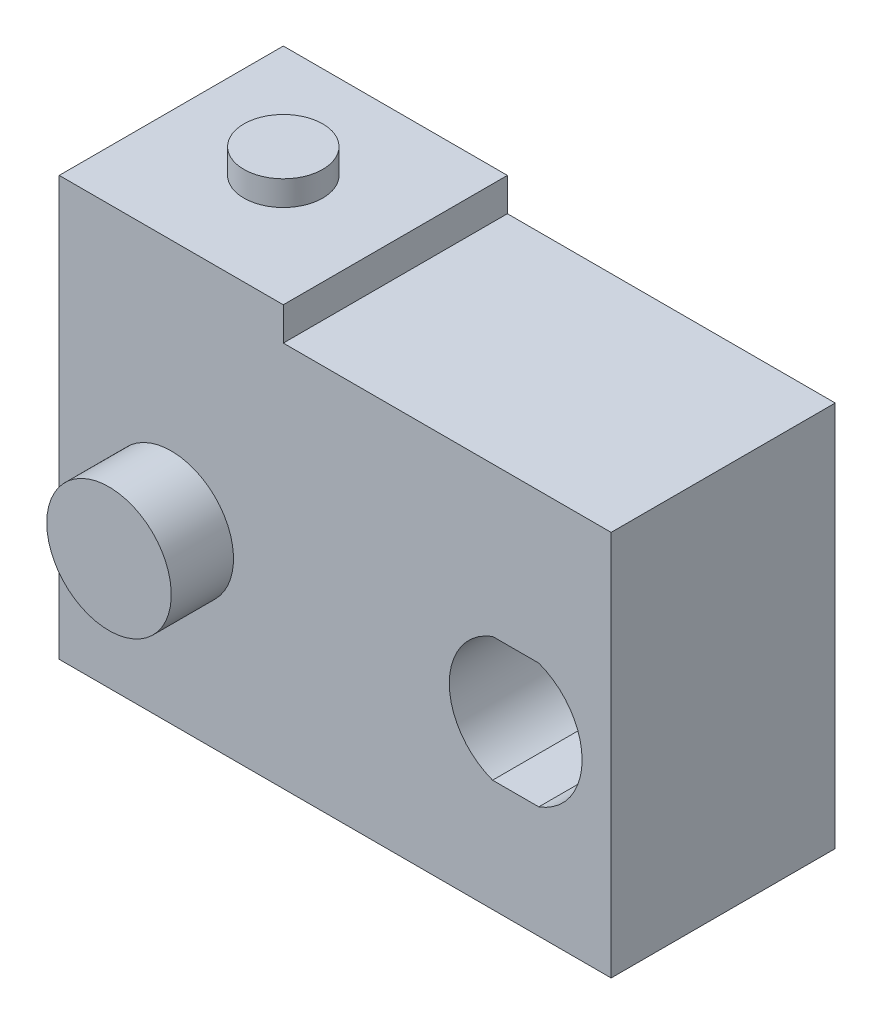
from build123d import *

# Parameters (mm, degrees)
BOSS_EXTRUDE1_DEPTH      = 2.7
BOSS_EXTRUDE2_DEPTH      = 4.2
BOSS_EXTRUDE2_DEPTH_BACK = 4.2
SKETCH3_R                = 1.5
SKETCH4_R                = 0.95
BOSS_EXTRUDE3_DEPTH      = 0.6


with BuildPart() as part:
    # Sketch1 → Boss-Extrude1 (new, symmetric)
    with BuildSketch(Plane.XY):
        Polygon((6.65, -4.65), (-6.65, -4.65), (-6.65, 4.65), (-6.65, 5.45), (-1.25, 5.45), (-1.25, 4.65), (6.65, 4.65), align=None)
        with BuildLine():
            Line((3.793223564, 1.05), (4.906776436, 1.05))
            ThreePointArc((4.906776436, 1.05), (5.95, -0.45), (4.906776436, -1.95))
            Line((4.906776436, -1.95), (3.793223564, -1.95))
            ThreePointArc((3.793223564, -1.95), (2.75, -0.45), (3.793223564, 1.05))
        make_face(mode=Mode.SUBTRACT)
    extrude(amount=BOSS_EXTRUDE1_DEPTH, both=True)

    # Sketch3 → Boss-Extrude2 (add, two sides: drawn at the far end of the back side and taken through both)
    with BuildSketch(Plane.XY.offset(-BOSS_EXTRUDE2_DEPTH_BACK)):
        with Locations(Location((-3.95, -0.45, 0), (0, 0, 180))):
            Circle(SKETCH3_R)
    extrude(amount=BOSS_EXTRUDE2_DEPTH + BOSS_EXTRUDE2_DEPTH_BACK)

    # Sketch4 → Boss-Extrude3 (add)
    with BuildSketch(Plane(origin=(0, 5.45, 0), x_dir=(1, 0, 0), z_dir=(0, 1, 0))):
        with Locations(Location((-3.95, 0, 0), (0, 0, 180))):
            Circle(SKETCH4_R)
    extrude(amount=BOSS_EXTRUDE3_DEPTH)


solid = part.part
